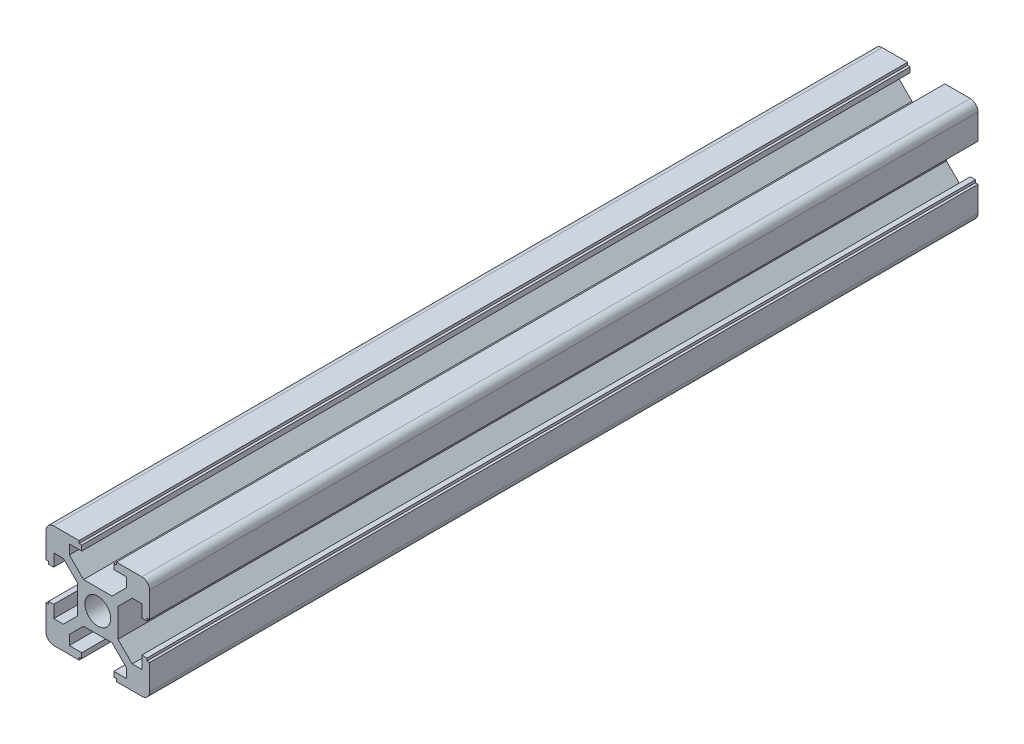
from build123d import *

# Parameters (mm, degrees)
SKETCH_2_R      = 2.5
EXTRUDE_1_DEPTH = 160


with BuildPart() as part:
    # 草图2 → 凸台-拉伸1 (new body)
    with BuildSketch(Plane.XY):
        with BuildLine():
            Line((-3.6, 10), (-3.6, 9.5))
            Line((-3.6, 9.5), (-3.1, 9.5))
            Line((-3.1, 9.5), (-3.1, 8.5))
            Line((-3.1, 8.5), (-5.5, 8.5))
            Line((-5.5, 8.5), (-5.5, 6.65))
            Line((-5.5, 6.65), (-2.75, 3.9))
            Line((-2.75, 3.9), (2.75, 3.9))
            Line((2.75, 3.9), (5.5, 6.65))
            Line((5.5, 6.65), (5.5, 8.5))
            Line((5.5, 8.5), (3.1, 8.5))
            Line((3.1, 8.5), (3.1, 9.5))
            Line((3.1, 9.5), (3.6, 9.5))
            Line((3.6, 9.5), (3.6, 10))
            Line((3.6, 10), (8.5, 10))
            ThreePointArc((8.5, 10), (9.560660172, 9.560660172), (10, 8.5))
            Line((10, 8.5), (10, 3.6))
            Line((10, 3.6), (9.5, 3.6))
            Line((9.5, 3.6), (9.5, 3.1))
            Line((9.5, 3.1), (8.5, 3.1))
            Line((8.5, 3.1), (8.5, 5.5))
            Line((8.5, 5.5), (6.65, 5.5))
            Line((6.65, 5.5), (3.9, 2.75))
            Line((3.9, 2.75), (3.9, -2.75))
            Line((3.9, -2.75), (6.65, -5.5))
            Line((6.65, -5.5), (8.5, -5.5))
            Line((8.5, -5.5), (8.5, -3.1))
            Line((8.5, -3.1), (9.5, -3.1))
            Line((9.5, -3.1), (9.5, -3.6))
            Line((9.5, -3.6), (10, -3.6))
            Line((10, -3.6), (10, -8.5))
            ThreePointArc((10, -8.5), (9.560660172, -9.560660172), (8.5, -10))
            Line((8.5, -10), (3.6, -10))
            Line((3.6, -10), (3.6, -9.5))
            Line((3.6, -9.5), (3.1, -9.5))
            Line((3.1, -9.5), (3.1, -8.5))
            Line((3.1, -8.5), (5.5, -8.5))
            Line((5.5, -8.5), (5.5, -6.65))
            Line((5.5, -6.65), (2.75, -3.9))
            Line((2.75, -3.9), (-2.75, -3.9))
            Line((-2.75, -3.9), (-5.5, -6.65))
            Line((-5.5, -6.65), (-5.5, -8.5))
            Line((-5.5, -8.5), (-3.1, -8.5))
            Line((-3.1, -8.5), (-3.1, -9.5))
            Line((-3.1, -9.5), (-3.6, -9.5))
            Line((-3.6, -9.5), (-3.6, -10))
            Line((-3.6, -10), (-8.5, -10))
            ThreePointArc((-8.5, -10), (-9.560660172, -9.560660172), (-10, -8.5))
            Line((-10, -8.5), (-10, -3.6))
            Line((-10, -3.6), (-9.5, -3.6))
            Line((-9.5, -3.6), (-9.5, -3.1))
            Line((-9.5, -3.1), (-8.5, -3.1))
            Line((-8.5, -3.1), (-8.5, -5.5))
            Line((-8.5, -5.5), (-6.65, -5.5))
            Line((-6.65, -5.5), (-3.9, -2.75))
            Line((-3.9, -2.75), (-3.9, 2.75))
            Line((-3.9, 2.75), (-6.65, 5.5))
            Line((-6.65, 5.5), (-8.5, 5.5))
            Line((-8.5, 5.5), (-8.5, 3.1))
            Line((-8.5, 3.1), (-9.5, 3.1))
            Line((-9.5, 3.1), (-9.5, 3.6))
            Line((-9.5, 3.6), (-10, 3.6))
            Line((-10, 3.6), (-10, 8.5))
            ThreePointArc((-10, 8.5), (-9.560660172, 9.560660172), (-8.5, 10))
            Line((-8.5, 10), (-3.6, 10))
        make_face()
        Circle(SKETCH_2_R, mode=Mode.SUBTRACT)
    extrude(amount=EXTRUDE_1_DEPTH)


solid = part.part
